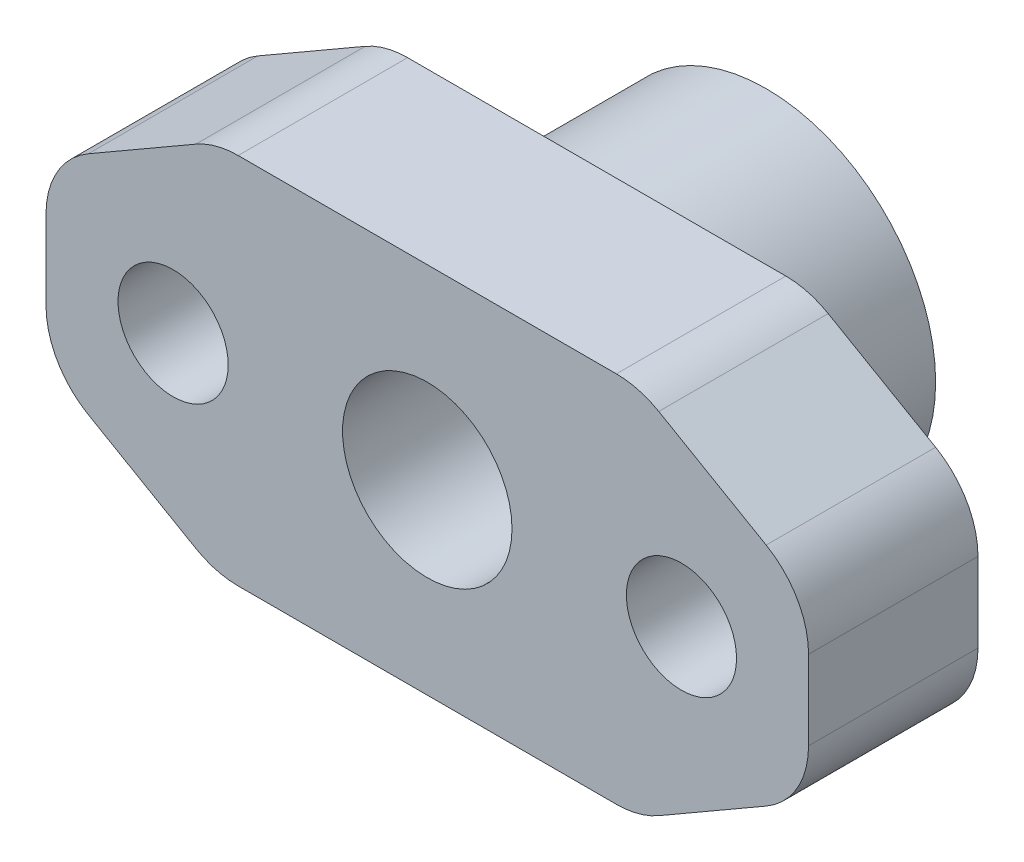
from build123d import *

# Parameters (mm, degrees)
ESQUISSE1_R                  = 10
ESQUISSE1_R_2                = 5
BOSS_EXTRU_1_DEPTH           = 20
BOSS_EXTRU_2_START           = -10
ESQUISSE2_R                  = 5
BOSS_EXTRU_2_DEPTH           = 10
ENL_V_MAT_EXTRU_1_DEPTH      = 33.050741021
ENL_V_MAT_EXTRU_1_DEPTH_BACK = 33.050741021
ESQUISSE3_R                  = 3.25
CONG_1_R                     = 5


with BuildPart() as part:
    # Esquisse1 → Boss.-Extru.1 (new body)
    with BuildSketch(Plane.XY):
        Circle(ESQUISSE1_R)
        Circle(ESQUISSE1_R_2, mode=Mode.SUBTRACT)
    extrude(amount=BOSS_EXTRU_1_DEPTH)

    # Esquisse2 → Boss.-Extru.2 (add)
    with BuildSketch(Plane.XY.offset(20).offset(BOSS_EXTRU_2_START)):
        Polygon((22.5, -5.226497308), (22.5, 5.226497308), (12.5, 11), (-12.5, 11), (-22.5, 5.226497308), (-22.5, -5.226497308), (-12.5, -11), (12.5, -11), align=None)
        Circle(ESQUISSE2_R, mode=Mode.SUBTRACT)
    extrude(amount=BOSS_EXTRU_2_DEPTH)

    # Esquisse3 → Enlèv. mat.-Extru.1 (cut, two sides: drawn at the far end of the back side and taken through both)
    with BuildSketch(Plane.XY.offset(20).offset(-ENL_V_MAT_EXTRU_1_DEPTH_BACK)):
        with Locations((15, 0)):
            Circle(ESQUISSE3_R)
        with Locations((-15, 0)):
            Circle(ESQUISSE3_R)
    extrude(amount=ENL_V_MAT_EXTRU_1_DEPTH + ENL_V_MAT_EXTRU_1_DEPTH_BACK, mode=Mode.SUBTRACT)

    # Congé1
    cong_1_edges = [part.edges().sort_by_distance(p)[0] for p in [
        (22.5, -5.226497308, 15),
        (12.5, -11, 15),
        (-12.5, -11, 15),
        (-22.5, -5.226497308, 15),
        (-22.5, 5.226497308, 15),
        (-12.5, 11, 15),
        (12.5, 11, 15),
        (22.5, 5.226497308, 15),
    ]]
    fillet(cong_1_edges, radius=CONG_1_R)


solid = part.part
